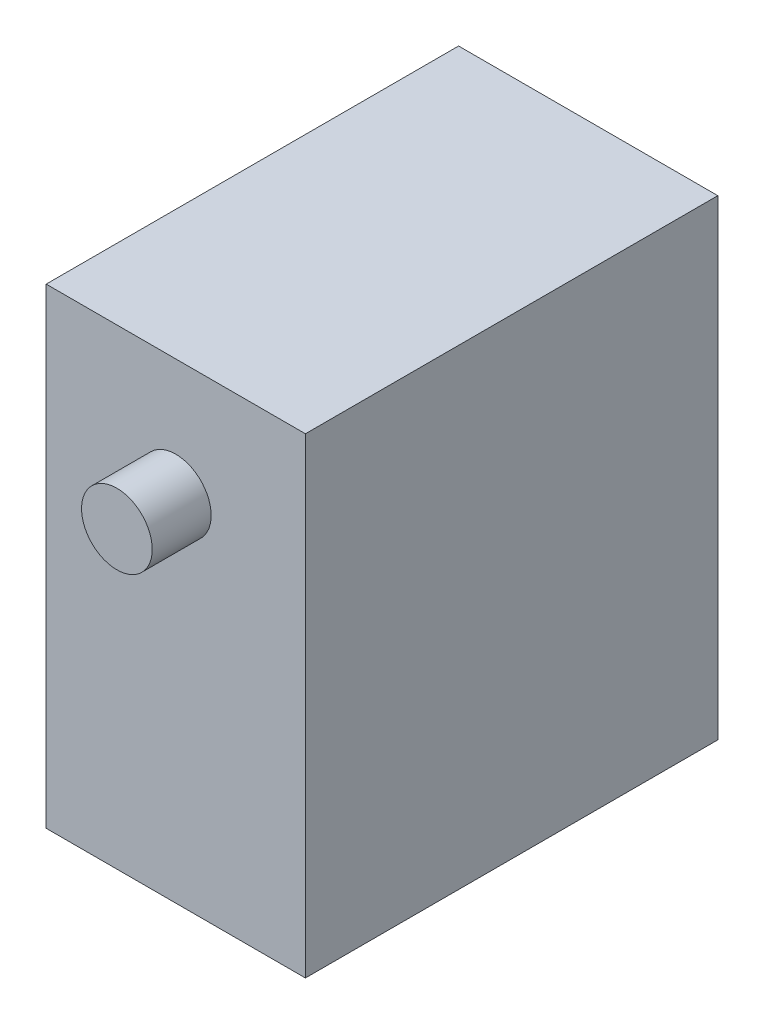
from build123d import *

# Parameters (mm, degrees)
SKETCH1_W           = 22
SKETCH1_H           = 40
SKETCH1_R           = 3
BOSS_EXTRUDE1_DEPTH = 35
SKETCH1_2_R         = 3
BOSS_EXTRUDE2_DEPTH = 40


with BuildPart() as part:
    # Sketch1 → Boss-Extrude1 (new body)
    with BuildSketch(Plane.XY):
        Rectangle(SKETCH1_W, SKETCH1_H)
        with Locations((0, 10)):
            Circle(SKETCH1_R, mode=Mode.SUBTRACT)
    extrude(amount=BOSS_EXTRUDE1_DEPTH)

    # Sketch1<2> → Boss-Extrude2 (add)
    with BuildSketch(Plane.XY):
        with Locations((0, 10)):
            Circle(SKETCH1_2_R)
    extrude(amount=BOSS_EXTRUDE2_DEPTH)


solid = part.part
